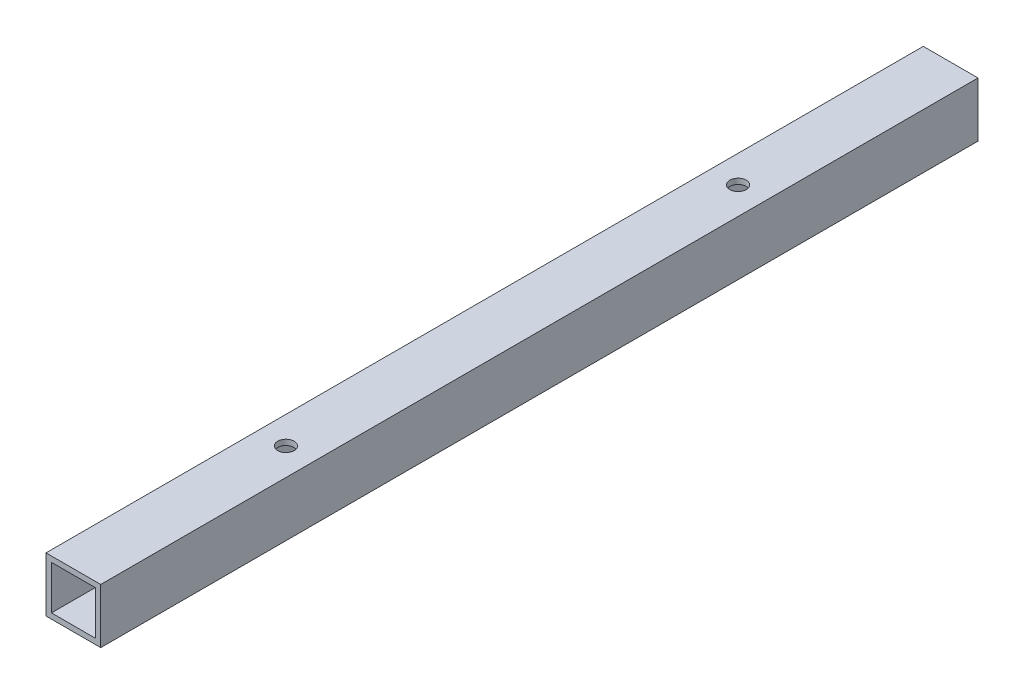
from build123d import *

# Parameters (mm, degrees)
SKETCH_1_W      = 10
SKETCH_1_H      = 10
SKETCH_1_W_2    = 8
SKETCH_1_H_2    = 8
EXTRUDE_1_DEPTH = 80.155
HOLE_WIZARD_1_D = 3


with BuildPart() as part:
    # 草图1 → 凸台-拉伸1 (new, symmetric)
    with BuildSketch(Plane.XY):
        Rectangle(SKETCH_1_W, SKETCH_1_H)
        Rectangle(SKETCH_1_W_2, SKETCH_1_H_2, mode=Mode.SUBTRACT)
    extrude(amount=EXTRUDE_1_DEPTH, both=True)

    # 孔1 (through all)
    with Locations(Plane(origin=(0, -5, 0), x_dir=(-1, 0, 0), z_dir=(0, -1, 0))):
        with Locations((0.003475522, -41.312740983), (0.003475522, 41.312740983)):
            Hole(HOLE_WIZARD_1_D / 2)


solid = part.part
